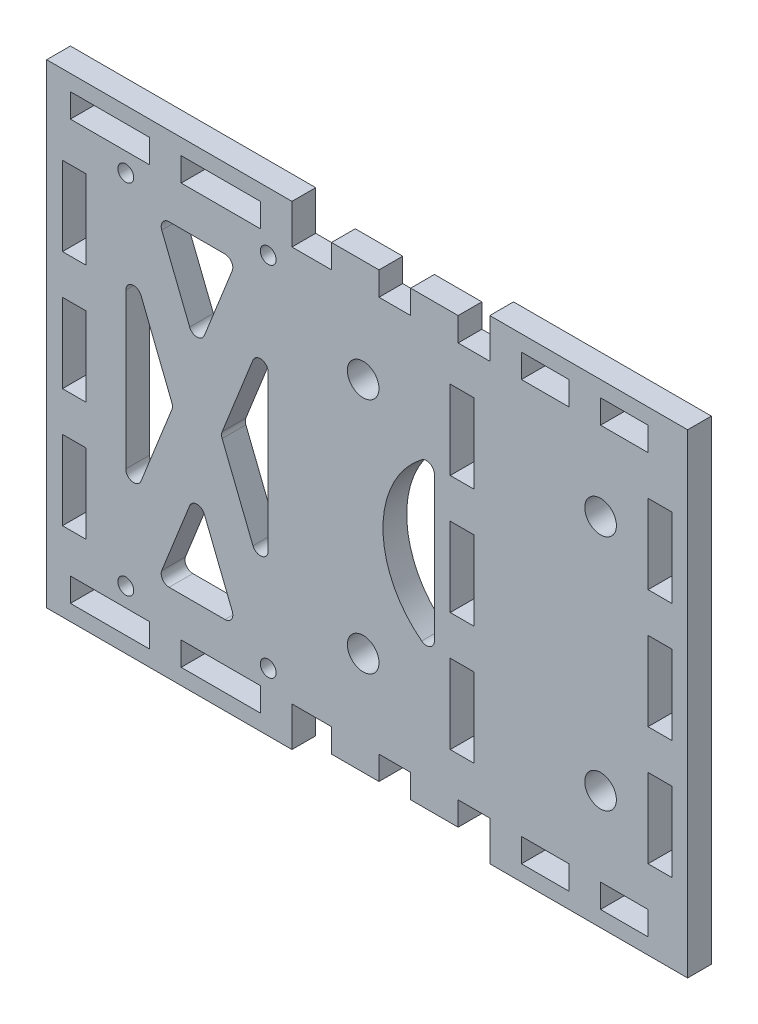
from build123d import *

# Parameters (mm, degrees)
SKETCH_1_R          = 2
SKETCH_1_W          = 3
SKETCH_1_H          = 10
EXTRUDE_1_DEPTH     = 3
SKETCH_2_W          = 3
SKETCH_2_H          = 60
EXTRUDE_2_DEPTH     = 31
SKETCH_3_W          = 25
SKETCH_3_H          = 3
EXTRUDE_3_DEPTH     = 5
SKETCH_4_W          = 10
SKETCH_4_H          = 3
SKETCH_4_W_2        = 6
SKETCH_4_W_3        = 3
SKETCH_4_H_2        = 10
CUT_EXTRUDE_1_DEPTH = 3
SKETCH_5_R          = 1
CUT_EXTRUDE_2_DEPTH = 3
FILLET_1_R          = 1


with BuildPart() as part:
    # 草图1 → 凸台-拉伸1 (new body)
    with BuildSketch(Plane.XY):
        Polygon((-5, 25), (-5, 28), (1, 28), (1, 25), (5, 25), (10, 25), (20, 25), (25, 25), (30, 25), (30, -25), (25, -25), (20, -25), (10, -25), (5, -25), (1, -25), (1, -28), (-5, -28), (-5, -25), (-9, -25), (-9, -28), (-15, -28), (-15, -25), (-20, -25), (-20, 25), (-15, 25), (-15, 28), (-9, 28), (-9, 25), align=None)
        with Locations((-11, 15)):
            Circle(SKETCH_1_R, mode=Mode.SUBTRACT)
        with Locations((-11, -15)):
            Circle(SKETCH_1_R, mode=Mode.SUBTRACT)
        with Locations((19, -15)):
            Circle(SKETCH_1_R, mode=Mode.SUBTRACT)
        with Locations((19, 15)):
            Circle(SKETCH_1_R, mode=Mode.SUBTRACT)
        with Locations((26.5, 15)):
            Rectangle(SKETCH_1_W, SKETCH_1_H, mode=Mode.SUBTRACT)
        with Locations((26.5, 0)):
            Rectangle(SKETCH_1_W, SKETCH_1_H, mode=Mode.SUBTRACT)
        with Locations((26.5, -15)):
            Rectangle(SKETCH_1_W, SKETCH_1_H, mode=Mode.SUBTRACT)
        with Locations((1.5, 0)):
            Rectangle(SKETCH_1_W, SKETCH_1_H, mode=Mode.SUBTRACT)
        with Locations((1.5, -15)):
            Rectangle(SKETCH_1_W, SKETCH_1_H, mode=Mode.SUBTRACT)
        with Locations((1.5, 15)):
            Rectangle(SKETCH_1_W, SKETCH_1_H, mode=Mode.SUBTRACT)
    extrude(amount=EXTRUDE_1_DEPTH)

    # 草图2 → 凸台-拉伸2 (add)
    with BuildSketch(Plane.ZY.offset(20)):
        with Locations((1.5, 0)):
            Rectangle(SKETCH_2_W, SKETCH_2_H)
    extrude(amount=EXTRUDE_2_DEPTH)

    # 草图3 → 凸台-拉伸3 (add)
    with BuildSketch(Plane(origin=(0, 25, 0), x_dir=(1, 0, 0), z_dir=(0, 1, 0))):
        with Locations((17.5, -1.5)):
            Rectangle(SKETCH_3_W, SKETCH_3_H)
    extrude_3 = extrude(amount=EXTRUDE_3_DEPTH)

    # 镜向1: 凸台-拉伸3 across plane
    add(extrude_3.mirror(Plane.ZX))

    # 草图4 → 切除-拉伸1 (cut)
    with BuildSketch(Plane.XY.offset(3)):
        with Locations((-43, 26.5)):
            Rectangle(SKETCH_4_W, SKETCH_4_H)
        with Locations((-29, 26.5)):
            Rectangle(SKETCH_4_W, SKETCH_4_H)
        with Locations((12, 26.5)):
            Rectangle(SKETCH_4_W_2, SKETCH_4_H)
        with Locations((22, 26.5)):
            Rectangle(SKETCH_4_W_2, SKETCH_4_H)
        with Locations((22, -26.5)):
            Rectangle(SKETCH_4_W_2, SKETCH_4_H)
        with Locations((12, -26.5)):
            Rectangle(SKETCH_4_W_2, SKETCH_4_H)
        with Locations((-29, -26.5)):
            Rectangle(SKETCH_4_W, SKETCH_4_H)
        with Locations((-43, -26.5)):
            Rectangle(SKETCH_4_W, SKETCH_4_H)
        with Locations((-47.5, 0)):
            Rectangle(SKETCH_4_W_3, SKETCH_4_H_2)
        with Locations((-47.5, 15)):
            Rectangle(SKETCH_4_W_3, SKETCH_4_H_2)
        with Locations((-47.5, -15)):
            Rectangle(SKETCH_4_W_3, SKETCH_4_H_2)
    extrude(amount=-CUT_EXTRUDE_1_DEPTH, mode=Mode.SUBTRACT)

    # 草图5 → 切除-拉伸2 (cut)
    with BuildSketch(Plane(origin=(0, 0, 0), x_dir=(-1, 0, 0), z_dir=(0, 0, -1))):
        with Locations((23, 22.6)):
            Circle(SKETCH_5_R)
        with Locations((41, 22.6)):
            Circle(SKETCH_5_R)
        with Locations((41, -22.6)):
            Circle(SKETCH_5_R)
        with Locations((23, -22.6)):
            Circle(SKETCH_5_R)
        with BuildLine():
            Line((2, 7.351919832), (2, -7.055869369))
            Line((2, -7.055869369), (2, -10.9658561))
            ThreePointArc((2, -10.9658561), (8.5, 0), (2, 10.9658561))
            Line((2, 10.9658561), (2, 7.351919832))
        make_face()
        Polygon((23, -15), (23, 15), (28.973451327, 0), align=None)
        Polygon((27, -20), (32, -7.444444444), (37, -20), align=None)
        Polygon((41, -15), (35.026548673, 0), (41, 15), align=None)
        Polygon((27, 20), (37, 20), (32, 7.444444444), align=None)
    extrude(amount=-CUT_EXTRUDE_2_DEPTH, mode=Mode.SUBTRACT)

    # 圆角1
    fillet_1_edges = [part.edges().sort_by_distance(p)[0] for p in [
        (-2, 10.9658561, 1.5),
        (-2, -10.9658561, 1.5),
        (-23, 15, 1.5),
        (-28.973451327, 0, 1.5),
        (-23, -15, 1.5),
        (-37, 20, 1.5),
        (-32, 7.444444444, 1.5),
        (-27, 20, 1.5),
        (-41, 15, 1.5),
        (-41, -15, 1.5),
        (-35.026548673, 0, 1.5),
        (-37, -20, 1.5),
        (-27, -20, 1.5),
        (-32, -7.444444444, 1.5),
    ]]
    fillet(fillet_1_edges, radius=FILLET_1_R)


solid = part.part
